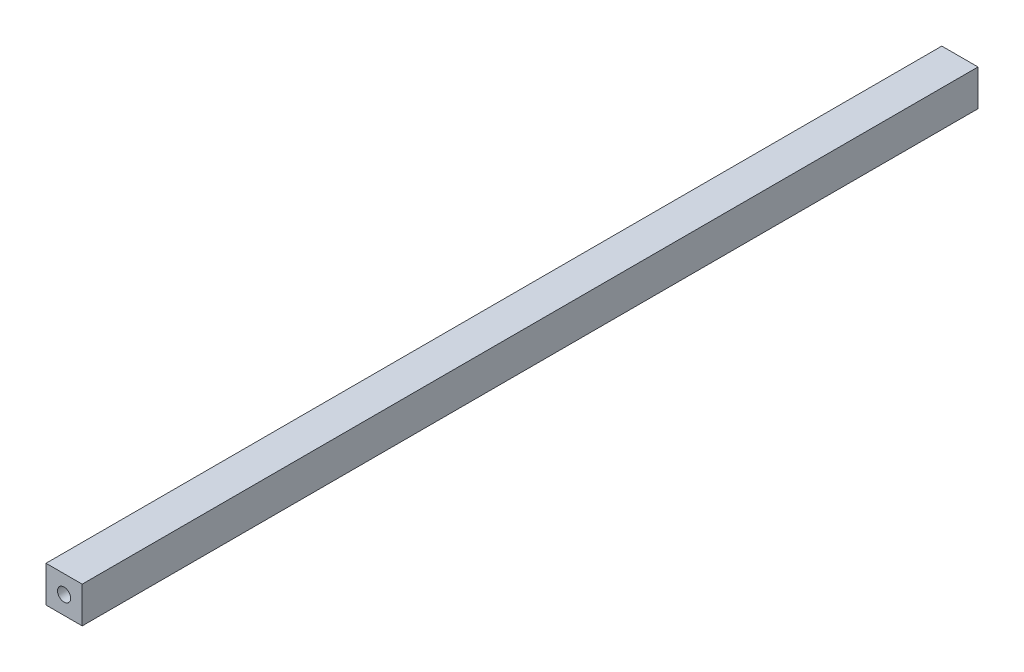
from build123d import *

# Parameters (mm, degrees)
SKETCH1_W           = 8
SKETCH1_H           = 8
BOSS_EXTRUDE1_DEPTH = 99
SKETCH2_R           = 1.45
CUT_EXTRUDE1_DEPTH  = 198


with BuildPart() as part:
    # Sketch1 → Boss-Extrude1 (new, symmetric)
    with BuildSketch(Plane.XY):
        Rectangle(SKETCH1_W, SKETCH1_H)
    extrude(amount=BOSS_EXTRUDE1_DEPTH, both=True)

    # Sketch2 → Cut-Extrude1 (cut)
    with BuildSketch(Plane.XY.offset(99)):
        Circle(SKETCH2_R)
    extrude(amount=-CUT_EXTRUDE1_DEPTH, mode=Mode.SUBTRACT)


solid = part.part
